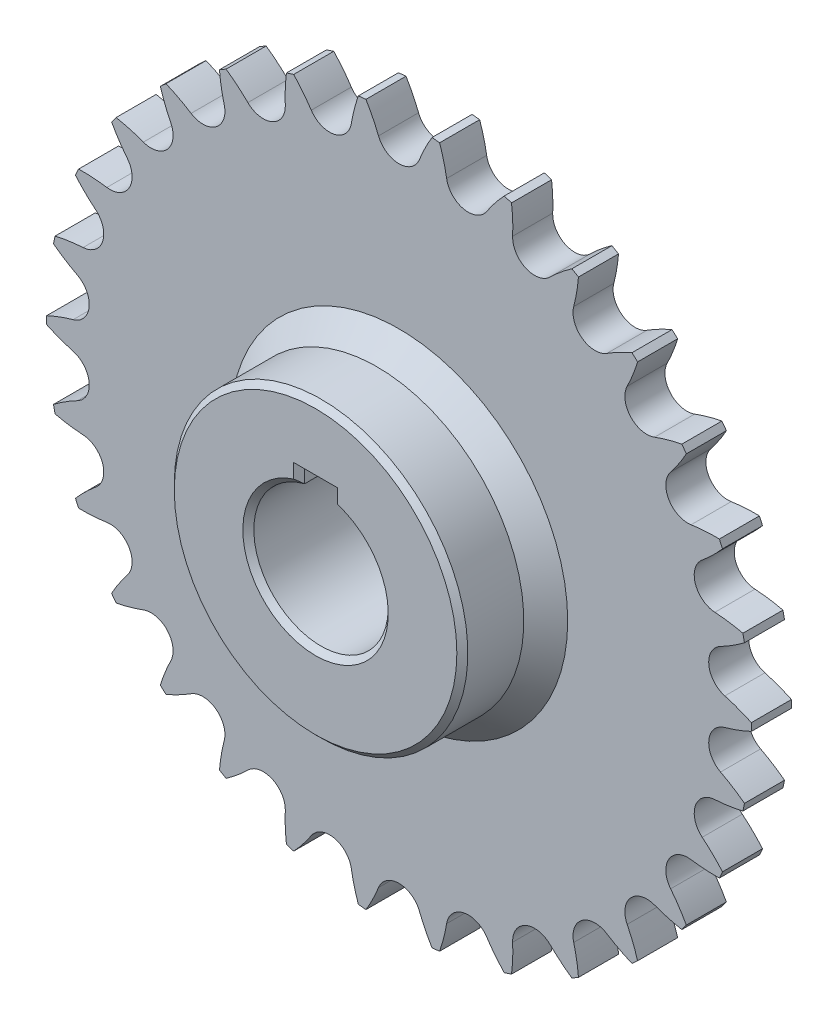
from build123d import *

# Parameters (mm, degrees)
SKETCH1_R           = 24.5
BOSS_EXTRUDE1_DEPTH = 14.6
SKETCH2_R           = 53.5
SKETCH2_R_2         = 24.5
BOSS_EXTRUDE2_DEPTH = 45
SKETCH4_W           = 12
SKETCH4_H           = 8
CUT_EXTRUDE1_DEPTH  = 107.4
CHAMFER1_SIZE       = 2
CHAMFER2_SIZE       = 8


with BuildPart() as part:
    # Sketch1 → Boss-Extrude1 (new body)
    with BuildSketch(Plane.XY):
        with BuildLine():
            ThreePointArc((118.768302174, 4.980561503), (112.935924719, 11.870044002), (117.208446778, 19.821594236))
            ThreePointArc((117.208446778, 19.821594236), (121.684887454, 22.398501862), (125.927191503, 25.344996457))
            ThreePointArc((125.927191503, 25.344996457), (125.645434813, 26.706761613), (125.348952569, 28.065396756))
            ThreePointArc((125.348952569, 28.065396756), (120.274967655, 29.031653002), (115.137412851, 29.565042806))
            ThreePointArc((115.137412851, 29.565042806), (108.000082882, 35.091354123), (110.52601983, 43.757451192))
            ThreePointArc((110.52601983, 43.757451192), (114.368870315, 47.208751554), (117.905859168, 50.972882781))
            ThreePointArc((117.905859168, 50.972882781), (117.347132642, 52.246309591), (116.774653117, 53.513613171))
            ThreePointArc((116.774653117, 53.513613171), (111.610650977, 53.403813617), (106.474466096, 52.857389868))
            ThreePointArc((106.474466096, 52.857389868), (98.344119182, 56.779003683), (99.013075452, 65.78089756))
            ThreePointArc((99.013075452, 65.78089756), (102.05438474, 69.95575227), (104.731475013, 74.373009531))
            ThreePointArc((104.731475013, 74.373009531), (103.920197681, 75.502443134), (103.096740976, 76.623027904))
            ThreePointArc((103.096740976, 76.623027904), (98.068413284, 75.441971317), (93.158074252, 73.839615355))
            ThreePointArc((93.158074252, 73.839615355), (84.390045565, 75.985138325), (83.172784559, 84.929403052))
            ThreePointArc((83.172784559, 84.929403052), (85.279632841, 89.645350927), (86.979822843, 94.522678884))
            ThreePointArc((86.979822843, 94.522678884), (85.951451416, 95.458757611), (84.913006542, 96.38364864))
            ThreePointArc((84.913006542, 96.38364864), (80.240115346, 94.182952861), (75.770227541, 91.59469533))
            ThreePointArc((75.770227541, 91.59469533), (66.747722009, 91.870357806), (63.697443874, 100.366086095))
            ThreePointArc((63.697443874, 100.366086095), (64.777751769, 105.417017583), (65.426735038, 110.5412536))
            ThreePointArc((65.426735038, 110.5412536), (64.226214284, 111.243066318), (63.018166264, 111.93184143))
            ThreePointArc((63.018166264, 111.93184143), (58.904939333, 108.807687424), (55.0708583, 105.346647599))
            ThreePointArc((55.0708583, 105.346647599), (46.18820271, 103.740401808), (41.438219238, 111.416289566))
            ThreePointArc((41.438219238, 111.416289566), (41.444772107, 116.581454723), (41.01418496, 121.728645097))
            ThreePointArc((41.01418496, 121.728645097), (39.693983397, 122.165519224), (38.369129726, 122.58807564))
            ThreePointArc((38.369129726, 122.58807564), (34.995334814, 118.677003929), (31.964628292, 114.494445858))
            ThreePointArc((31.964628292, 114.494445858), (23.610037317, 111.076492449), (17.367945578, 117.597066548))
            ThreePointArc((17.367945578, 117.597066548), (16.30045703, 122.650722872), (14.809118192, 127.595910685))
            ThreePointArc((14.809118192, 127.595910685), (13.426934961, 127.748752725), (12.043178103, 127.886622703))
            ThreePointArc((12.043178103, 127.886622703), (9.556266237, 123.359565887), (7.461390645, 118.638287428))
            ThreePointArc((7.461390645, 118.638287428), (0, 113.558007366), (-7.461390645, 118.638287428))
            ThreePointArc((-7.461390645, 118.638287428), (-9.556266237, 123.359565888), (-12.043178104, 127.886622703))
            ThreePointArc((-12.043178104, 127.886622703), (-13.426934961, 127.748752725), (-14.809118192, 127.595910685))
            ThreePointArc((-14.809118192, 127.595910685), (-16.30045703, 122.650722872), (-17.367945578, 117.597066548))
            ThreePointArc((-17.367945578, 117.597066548), (-23.610037317, 111.076492449), (-31.964628292, 114.494445858))
            ThreePointArc((-31.964628292, 114.494445858), (-34.995334814, 118.677003929), (-38.369129726, 122.588075641))
            ThreePointArc((-38.369129726, 122.588075641), (-39.693983397, 122.165519224), (-41.014184961, 121.728645097))
            ThreePointArc((-41.014184961, 121.728645097), (-41.444772107, 116.581454723), (-41.438219238, 111.416289566))
            ThreePointArc((-41.438219238, 111.416289566), (-46.18820271, 103.740401808), (-55.0708583, 105.346647599))
            ThreePointArc((-55.0708583, 105.346647599), (-58.904939333, 108.807687424), (-63.018166264, 111.93184143))
            ThreePointArc((-63.018166264, 111.93184143), (-64.226214284, 111.243066318), (-65.426735038, 110.5412536))
            ThreePointArc((-65.426735038, 110.5412536), (-64.777751769, 105.417017583), (-63.697443874, 100.366086095))
            ThreePointArc((-63.697443874, 100.366086095), (-66.747722009, 91.870357806), (-75.770227541, 91.59469533))
            ThreePointArc((-75.770227541, 91.59469533), (-80.240115347, 94.182952861), (-84.913006542, 96.38364864))
            ThreePointArc((-84.913006542, 96.38364864), (-85.951451416, 95.458757611), (-86.979822842, 94.522678884))
            ThreePointArc((-86.979822842, 94.522678884), (-85.279632841, 89.645350928), (-83.172784559, 84.929403052))
            ThreePointArc((-83.172784559, 84.929403052), (-84.390045565, 75.985138325), (-93.158074252, 73.839615356))
            ThreePointArc((-93.158074252, 73.839615356), (-98.068413284, 75.441971317), (-103.096740976, 76.623027904))
            ThreePointArc((-103.096740976, 76.623027904), (-103.920197681, 75.502443134), (-104.731475013, 74.373009532))
            ThreePointArc((-104.731475013, 74.373009532), (-102.05438474, 69.955752271), (-99.013075452, 65.78089756))
            ThreePointArc((-99.013075452, 65.78089756), (-98.344119182, 56.779003683), (-106.474466096, 52.857389868))
            ThreePointArc((-106.474466096, 52.857389868), (-111.610650977, 53.403813617), (-116.774653117, 53.513613171))
            ThreePointArc((-116.774653117, 53.513613171), (-117.347132642, 52.246309591), (-117.905859168, 50.972882781))
            ThreePointArc((-117.905859168, 50.972882781), (-114.368870314, 47.208751554), (-110.526019829, 43.757451192))
            ThreePointArc((-110.526019829, 43.757451192), (-108.000082883, 35.091354123), (-115.137412851, 29.565042806))
            ThreePointArc((-115.137412851, 29.565042806), (-120.274967655, 29.031653002), (-125.348952569, 28.065396756))
            ThreePointArc((-125.348952569, 28.065396756), (-125.645434813, 26.706761614), (-125.927191503, 25.344996458))
            ThreePointArc((-125.927191503, 25.344996458), (-121.684887454, 22.398501863), (-117.208446778, 19.821594235))
            ThreePointArc((-117.208446778, 19.821594235), (-112.935924719, 11.870044002), (-118.768302174, 4.980561504))
            ThreePointArc((-118.768302174, 4.980561504), (-123.682691103, 3.390669841), (-128.444901303, 1.39058783))
            ThreePointArc((-128.444901303, 1.39058783), (-128.452428569, 0), (-128.444901303, -1.39058783))
            ThreePointArc((-128.444901303, -1.39058783), (-123.682691103, -3.390669841), (-118.768302174, -4.980561503))
            ThreePointArc((-118.768302174, -4.980561503), (-112.935924719, -11.870044002), (-117.208446778, -19.821594236))
            ThreePointArc((-117.208446778, -19.821594236), (-121.684887454, -22.398501862), (-125.927191503, -25.344996457))
            ThreePointArc((-125.927191503, -25.344996457), (-125.645434813, -26.706761613), (-125.348952569, -28.065396756))
            ThreePointArc((-125.348952569, -28.065396756), (-120.274967655, -29.031653002), (-115.137412851, -29.565042806))
            ThreePointArc((-115.137412851, -29.565042806), (-108.000082882, -35.091354123), (-110.52601983, -43.757451192))
            ThreePointArc((-110.52601983, -43.757451192), (-114.368870315, -47.208751554), (-117.905859168, -50.972882781))
            ThreePointArc((-117.905859168, -50.972882781), (-117.347132642, -52.246309591), (-116.774653117, -53.513613171))
            ThreePointArc((-116.774653117, -53.513613171), (-111.610650977, -53.403813617), (-106.474466096, -52.857389868))
            ThreePointArc((-106.474466096, -52.857389868), (-98.344119182, -56.779003683), (-99.013075452, -65.78089756))
            ThreePointArc((-99.013075452, -65.78089756), (-102.05438474, -69.95575227), (-104.731475013, -74.373009531))
            ThreePointArc((-104.731475013, -74.373009531), (-103.920197681, -75.502443134), (-103.096740976, -76.623027904))
            ThreePointArc((-103.096740976, -76.623027904), (-98.068413284, -75.441971317), (-93.158074252, -73.839615355))
            ThreePointArc((-93.158074252, -73.839615355), (-84.390045565, -75.985138325), (-83.172784559, -84.929403052))
            ThreePointArc((-83.172784559, -84.929403052), (-85.279632841, -89.645350927), (-86.979822843, -94.522678884))
            ThreePointArc((-86.979822843, -94.522678884), (-85.951451416, -95.458757611), (-84.913006542, -96.38364864))
            ThreePointArc((-84.913006542, -96.38364864), (-80.240115346, -94.182952861), (-75.770227541, -91.59469533))
            ThreePointArc((-75.770227541, -91.59469533), (-66.747722009, -91.870357806), (-63.697443874, -100.366086095))
            ThreePointArc((-63.697443874, -100.366086095), (-64.777751769, -105.417017583), (-65.426735038, -110.5412536))
            ThreePointArc((-65.426735038, -110.5412536), (-64.226214284, -111.243066318), (-63.018166264, -111.93184143))
            ThreePointArc((-63.018166264, -111.93184143), (-58.904939333, -108.807687424), (-55.0708583, -105.346647599))
            ThreePointArc((-55.0708583, -105.346647599), (-46.18820271, -103.740401808), (-41.438219238, -111.416289566))
            ThreePointArc((-41.438219238, -111.416289566), (-41.444772107, -116.581454723), (-41.01418496, -121.728645097))
            ThreePointArc((-41.01418496, -121.728645097), (-39.693983397, -122.165519224), (-38.369129726, -122.58807564))
            ThreePointArc((-38.369129726, -122.58807564), (-34.995334814, -118.677003929), (-31.964628292, -114.494445858))
            ThreePointArc((-31.964628292, -114.494445858), (-23.610037317, -111.076492449), (-17.367945578, -117.597066548))
            ThreePointArc((-17.367945578, -117.597066548), (-16.30045703, -122.650722872), (-14.809118192, -127.595910685))
            ThreePointArc((-14.809118192, -127.595910685), (-13.426934961, -127.748752725), (-12.043178103, -127.886622703))
            ThreePointArc((-12.043178103, -127.886622703), (-9.556266237, -123.359565887), (-7.461390645, -118.638287428))
            ThreePointArc((-7.461390645, -118.638287428), (0, -113.558007365), (7.461390645, -118.638287428))
            ThreePointArc((7.461390645, -118.638287428), (9.556266237, -123.359565888), (12.043178104, -127.886622703))
            ThreePointArc((12.043178104, -127.886622703), (13.426934961, -127.748752725), (14.809118192, -127.595910685))
            ThreePointArc((14.809118192, -127.595910685), (16.30045703, -122.650722872), (17.367945578, -117.597066548))
            ThreePointArc((17.367945578, -117.597066548), (23.610037317, -111.076492449), (31.964628292, -114.494445858))
            ThreePointArc((31.964628292, -114.494445858), (34.995334814, -118.677003929), (38.369129726, -122.588075641))
            ThreePointArc((38.369129726, -122.588075641), (39.693983397, -122.165519224), (41.014184961, -121.728645097))
            ThreePointArc((41.014184961, -121.728645097), (41.444772107, -116.581454723), (41.438219238, -111.416289566))
            ThreePointArc((41.438219238, -111.416289566), (46.18820271, -103.740401808), (55.0708583, -105.346647599))
            ThreePointArc((55.0708583, -105.346647599), (58.904939333, -108.807687424), (63.018166264, -111.93184143))
            ThreePointArc((63.018166264, -111.93184143), (64.226214284, -111.243066318), (65.426735038, -110.5412536))
            ThreePointArc((65.426735038, -110.5412536), (64.777751769, -105.417017583), (63.697443874, -100.366086095))
            ThreePointArc((63.697443874, -100.366086095), (66.747722009, -91.870357806), (75.770227541, -91.59469533))
            ThreePointArc((75.770227541, -91.59469533), (80.240115346, -94.18295286), (84.913006542, -96.38364864))
            ThreePointArc((84.913006542, -96.38364864), (85.951451416, -95.458757611), (86.979822842, -94.522678884))
            ThreePointArc((86.979822842, -94.522678884), (85.27963284, -89.645350928), (83.172784559, -84.929403052))
            ThreePointArc((83.172784559, -84.929403052), (84.390045565, -75.985138325), (93.158074252, -73.839615356))
            ThreePointArc((93.158074252, -73.839615356), (98.068413284, -75.441971317), (103.096740976, -76.623027904))
            ThreePointArc((103.096740976, -76.623027904), (103.920197681, -75.502443134), (104.731475013, -74.373009532))
            ThreePointArc((104.731475013, -74.373009532), (102.05438474, -69.955752271), (99.013075452, -65.78089756))
            ThreePointArc((99.013075452, -65.78089756), (98.344119182, -56.779003683), (106.474466096, -52.857389868))
            ThreePointArc((106.474466096, -52.857389868), (111.610650977, -53.403813617), (116.774653117, -53.513613171))
            ThreePointArc((116.774653117, -53.513613171), (117.347132642, -52.246309591), (117.905859168, -50.972882781))
            ThreePointArc((117.905859168, -50.972882781), (114.368870314, -47.208751554), (110.526019829, -43.757451192))
            ThreePointArc((110.526019829, -43.757451192), (108.000082883, -35.091354123), (115.137412851, -29.565042806))
            ThreePointArc((115.137412851, -29.565042806), (120.274967655, -29.031653002), (125.348952569, -28.065396756))
            ThreePointArc((125.348952569, -28.065396756), (125.645434813, -26.706761614), (125.927191503, -25.344996458))
            ThreePointArc((125.927191503, -25.344996458), (121.684887454, -22.398501863), (117.208446778, -19.821594235))
            ThreePointArc((117.208446778, -19.821594235), (112.935924719, -11.870044002), (118.768302174, -4.980561504))
            ThreePointArc((118.768302174, -4.980561504), (123.682691103, -3.390669841), (128.444901303, -1.39058783))
            ThreePointArc((128.444901303, -1.39058783), (128.452428569, 0), (128.444901303, 1.39058783))
            ThreePointArc((128.444901303, 1.39058783), (123.682691103, 3.390669841), (118.768302174, 4.980561503))
        make_face()
        Circle(SKETCH1_R, mode=Mode.SUBTRACT)
    extrude(amount=BOSS_EXTRUDE1_DEPTH)

    # Sketch2 → Boss-Extrude2 (add)
    with BuildSketch(Plane.XY):
        Circle(SKETCH2_R)
        Circle(SKETCH2_R_2, mode=Mode.SUBTRACT)
    extrude(amount=BOSS_EXTRUDE2_DEPTH)

    # Sketch4 → Cut-Extrude1 (cut)
    with BuildSketch(Plane.XY.offset(45)):
        with Locations((0, 24.5)):
            Rectangle(SKETCH4_W, SKETCH4_H)
    extrude(amount=-CUT_EXTRUDE1_DEPTH, mode=Mode.SUBTRACT)

    # Chamfer1
    chamfer1_edges = [part.edges().sort_by_distance(p)[0] for p in [
        (0, -24.5, 45),
        (-53.5, 0, 45),
        (0, 28.5, 45),
        (-6, 26.12697352, 45),
        (6, 26.12697352, 45),
        (0, -24.5, 0),
    ]]
    chamfer(chamfer1_edges, length=CHAMFER1_SIZE)

    # Chamfer2
    chamfer2_edges = [part.edges().sort_by_distance(p)[0] for p in [
        (-53.5, 0, 14.6),
    ]]
    chamfer(chamfer2_edges, length=CHAMFER2_SIZE)


solid = part.part
